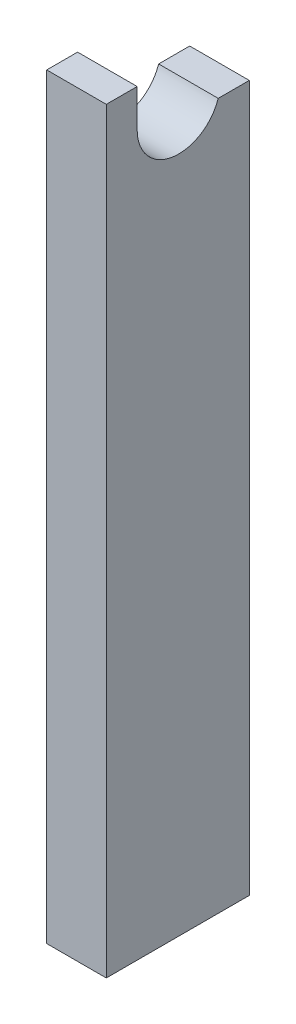
from build123d import *

# Parameters (mm, degrees)
BOSS_EXTRUDE1_DEPTH = 5


with BuildPart() as part:
    # Sketch1 → Boss-Extrude1 (new body)
    with BuildSketch(Plane(origin=(-334.6667478, 0, 0), x_dir=(0, 0, -1), z_dir=(1, 0, 0))):
        with BuildLine():
            Line((-577.545278836, -12.287859349), (-565.545278836, -12.287859349))
            Line((-565.545278836, -12.287859349), (-565.545278836, 35.712140651))
            Line((-565.545278836, 35.712140651), (-565.545278836, 46.94671314))
            Line((-565.545278836, 46.94671314), (-568.152554161, 46.94671314))
            ThreePointArc((-568.152554161, 46.94671314), (-572.022264181, 44.601240466), (-574.955437267, 48.046874421))
            Line((-574.955437267, 48.046874421), (-574.955437267, 51.208429545))
            Line((-574.955437267, 51.208429545), (-577.545278836, 51.208429545))
            Line((-577.545278836, 51.208429545), (-577.545278836, -12.287859349))
        make_face()
    extrude(amount=BOSS_EXTRUDE1_DEPTH)


solid = part.part
